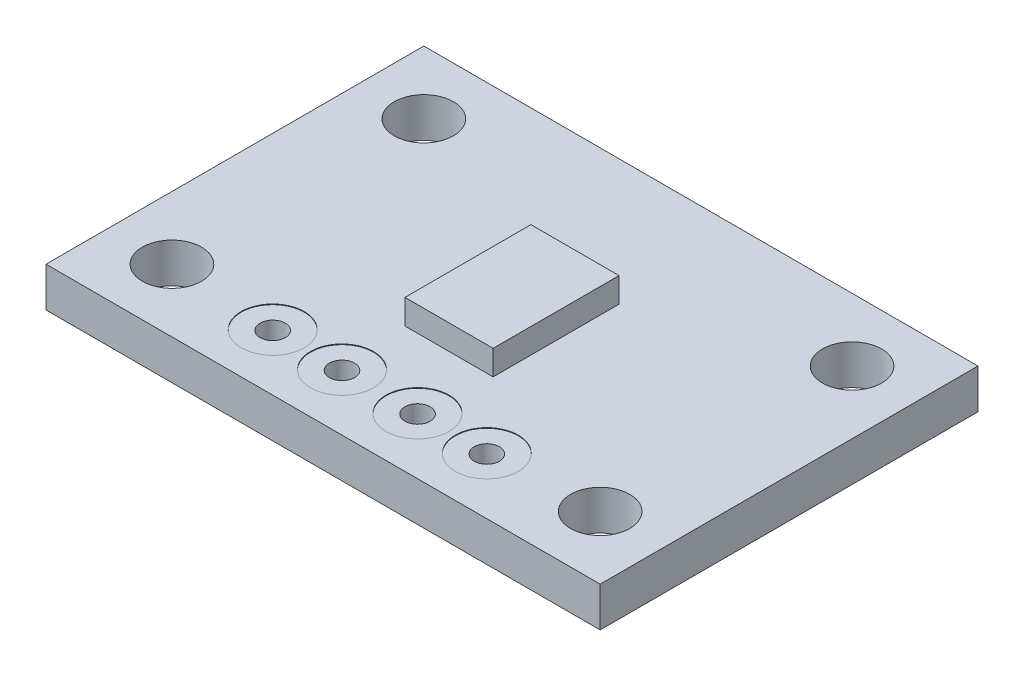
from build123d import *

# Parameters (mm, degrees)
SKETCH1_W               = 22.352
SKETCH1_H               = 15.24
SKETCH1_R               = 1.1938
BOSS_EXTRUDE1_DEPTH     = 0.8
SKETCH2_W               = 3.556
SKETCH2_H               = 5.08
BOSS_EXTRUDE2_DEPTH     = 1
CUT_EXTRUDE1_DEPTH      = 14.620843439
CUT_EXTRUDE1_DEPTH_BACK = 14.620843439
SKETCH3_R               = 0.508
SKETCH4_R               = 1.27
CUT_EXTRUDE2_DEPTH      = 0.0254


with BuildPart() as part:
    # Sketch1 → Boss-Extrude1 (new, symmetric)
    with BuildSketch(Plane(origin=(0, 0, 0), x_dir=(1, 0, 0), z_dir=(0, 1, 0))):
        Rectangle(SKETCH1_W, SKETCH1_H)
        with Locations((8.636, 5.08)):
            Circle(SKETCH1_R, mode=Mode.SUBTRACT)
        with Locations((8.636, -5.08)):
            Circle(SKETCH1_R, mode=Mode.SUBTRACT)
        with Locations((-8.636, -5.08)):
            Circle(SKETCH1_R, mode=Mode.SUBTRACT)
        with Locations((-8.636, 5.08)):
            Circle(SKETCH1_R, mode=Mode.SUBTRACT)
    extrude(amount=BOSS_EXTRUDE1_DEPTH, both=True)

    # Sketch2 → Boss-Extrude2 (add)
    with BuildSketch(Plane(origin=(0, 0.8, 0), x_dir=(1, 0, 0), z_dir=(0, 1, 0))):
        Rectangle(SKETCH2_W, SKETCH2_H)
    extrude(amount=BOSS_EXTRUDE2_DEPTH)

    # Sketch3 → Cut-Extrude1 (cut, two sides: drawn at the far end of the back side and taken through both)
    with BuildSketch(Plane(origin=(0, 0.8, 0), x_dir=(1, 0, 0), z_dir=(0, 1, 0)).offset(-CUT_EXTRUDE1_DEPTH_BACK)):
        with Locations((-1.524, -5.334)):
            Circle(SKETCH3_R)
        with Locations((-4.318, -5.334)):
            Circle(SKETCH3_R)
        with Locations((4.318, -5.334)):
            Circle(SKETCH3_R)
        with Locations((1.524, -5.334)):
            Circle(SKETCH3_R)
    extrude(amount=CUT_EXTRUDE1_DEPTH + CUT_EXTRUDE1_DEPTH_BACK, mode=Mode.SUBTRACT)

    # Sketch4 → Cut-Extrude2 (cut)
    with BuildSketch(Plane(origin=(0, 0.8, 0), x_dir=(1, 0, 0), z_dir=(0, 1, 0))):
        with Locations((-4.318, -5.334)):
            Circle(SKETCH4_R)
        with Locations((-1.524, -5.334)):
            Circle(SKETCH4_R)
        with Locations((1.524, -5.334)):
            Circle(SKETCH4_R)
        with Locations((4.318, -5.334)):
            Circle(SKETCH4_R)
    cut_extrude2 = extrude(amount=-CUT_EXTRUDE2_DEPTH, mode=Mode.SUBTRACT)

    # Mirror1: Cut-Extrude2 across plane
    add(cut_extrude2.mirror(Plane.ZX), mode=Mode.SUBTRACT)


solid = part.part
